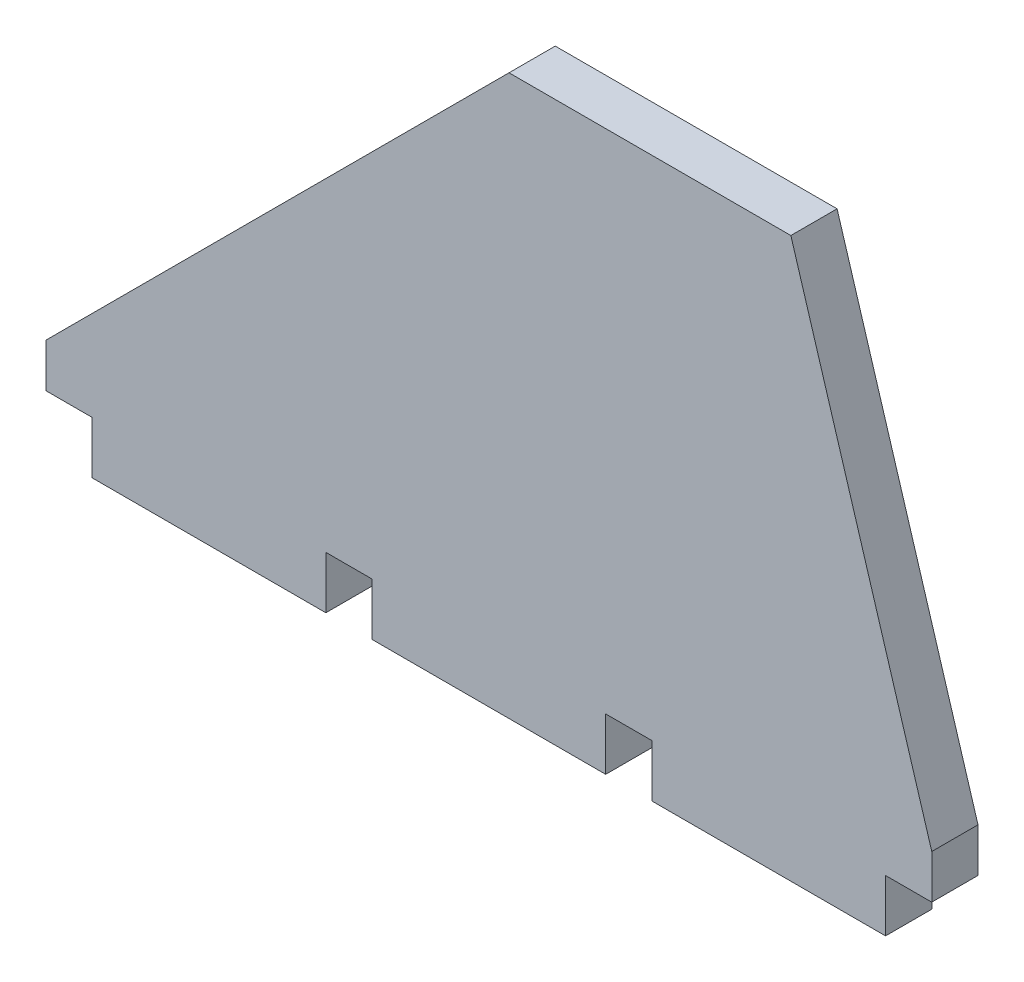
from build123d import *

# Parameters (mm, degrees)
BOSS_EXTRUDE1_DEPTH = 11.482


with BuildPart() as part:
    # Sketch1 → Boss-Extrude1 (new body)
    with BuildSketch(Plane.XY):
        Polygon((0, 0), (11.482, 0), (11.482, -13), (69.506, -13), (69.506, 0), (80.988, 0), (80.988, -13), (139.012, -13), (139.012, 0), (150.494, 0), (150.494, -13), (208.518, -13), (208.518, 0), (220, 0), (220, 10.9), (185, 125.9), (115, 125.9), (0, 10.9), align=None)
    extrude(amount=BOSS_EXTRUDE1_DEPTH)


solid = part.part
